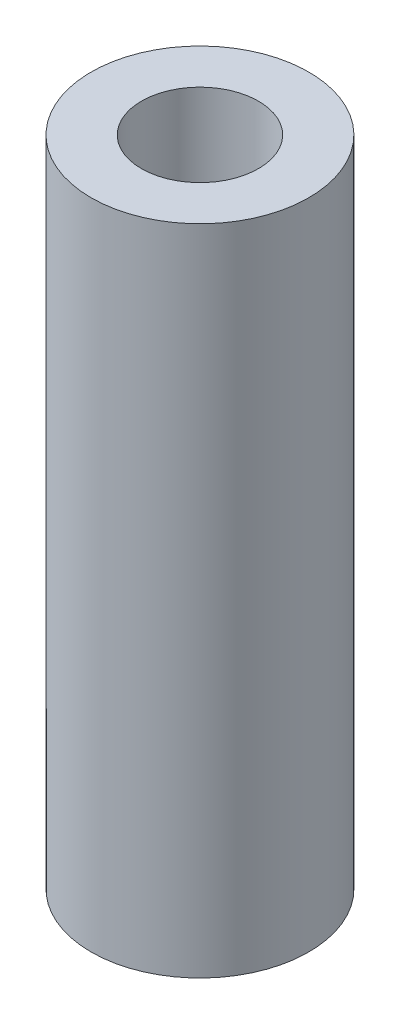
from build123d import *

# Parameters (mm, degrees)
SKETCH_1_R      = 4
SKETCH_1_R_2    = 2.15
EXTRUDE_1_DEPTH = 24


with BuildPart() as part:
    # 草图1 → 凸台-拉伸1 (new body)
    with BuildSketch(Plane(origin=(0, 0, 0), x_dir=(1, 0, 0), z_dir=(0, 1, 0))):
        with Locations(Location((0, 0, 0), (0, 0, 270))):
            Circle(SKETCH_1_R)
        with Locations(Location((0, 0, 0), (0, 0, 270))):
            Circle(SKETCH_1_R_2, mode=Mode.SUBTRACT)
    extrude(amount=EXTRUDE_1_DEPTH)


solid = part.part
